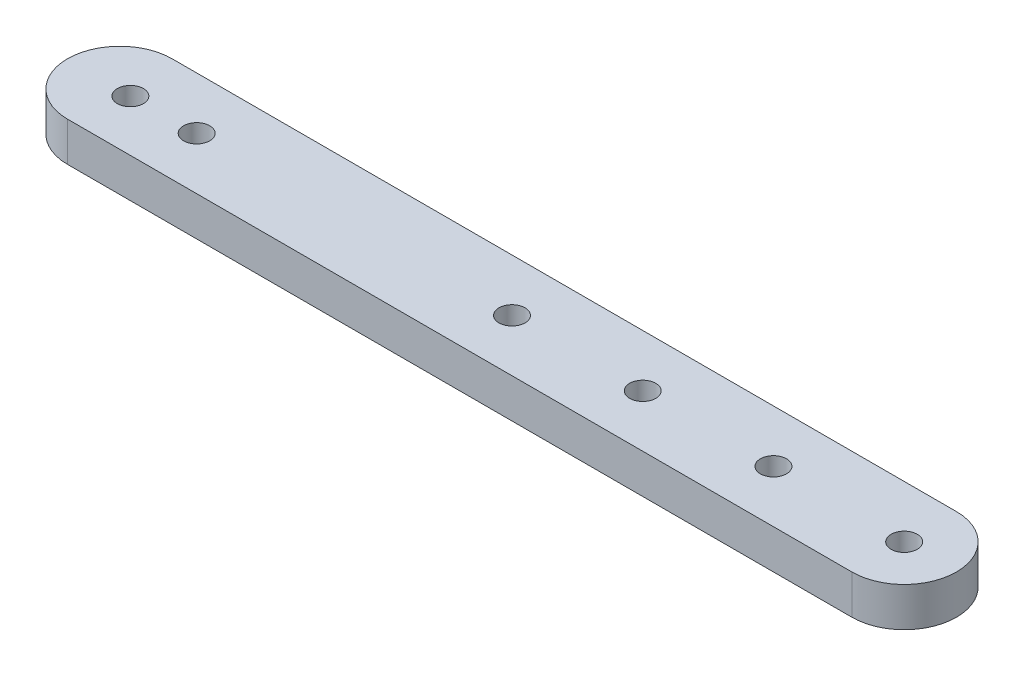
from build123d import *

# Parameters (mm, degrees)
SKETCH1_R           = 2
BOSS_EXTRUDE1_DEPTH = 6


with BuildPart() as part:
    # Sketch1 → Boss-Extrude1 (new body)
    with BuildSketch(Plane(origin=(0, 0, 0), x_dir=(1, 0, 0), z_dir=(0, 1, 0))):
        with BuildLine():
            Line((-60, -8), (60, -8))
            ThreePointArc((60, -8), (68, 0), (60, 8))
            Line((60, 8), (-60, 8))
            ThreePointArc((-60, 8), (-68, 0), (-60, -8))
        make_face()
        with Locations(Location((-58.245798805, -0.141038117, 0), (0, 0, 270))):
            Circle(SKETCH1_R, mode=Mode.SUBTRACT)
        with Locations(Location((60, 0, 0), (0, 0, 270))):
            Circle(SKETCH1_R, mode=Mode.SUBTRACT)
        with Locations(Location((20, 0, 0), (0, 0, 270))):
            Circle(SKETCH1_R, mode=Mode.SUBTRACT)
        with Locations(Location((-48.245798805, 0, 0), (0, 0, 270))):
            Circle(SKETCH1_R, mode=Mode.SUBTRACT)
        with Locations(Location((40, 0, 0), (0, 0, 270))):
            Circle(SKETCH1_R, mode=Mode.SUBTRACT)
        with Locations(Location((0, 0, 0), (0, 0, 270))):
            Circle(SKETCH1_R, mode=Mode.SUBTRACT)
    extrude(amount=BOSS_EXTRUDE1_DEPTH)


solid = part.part
